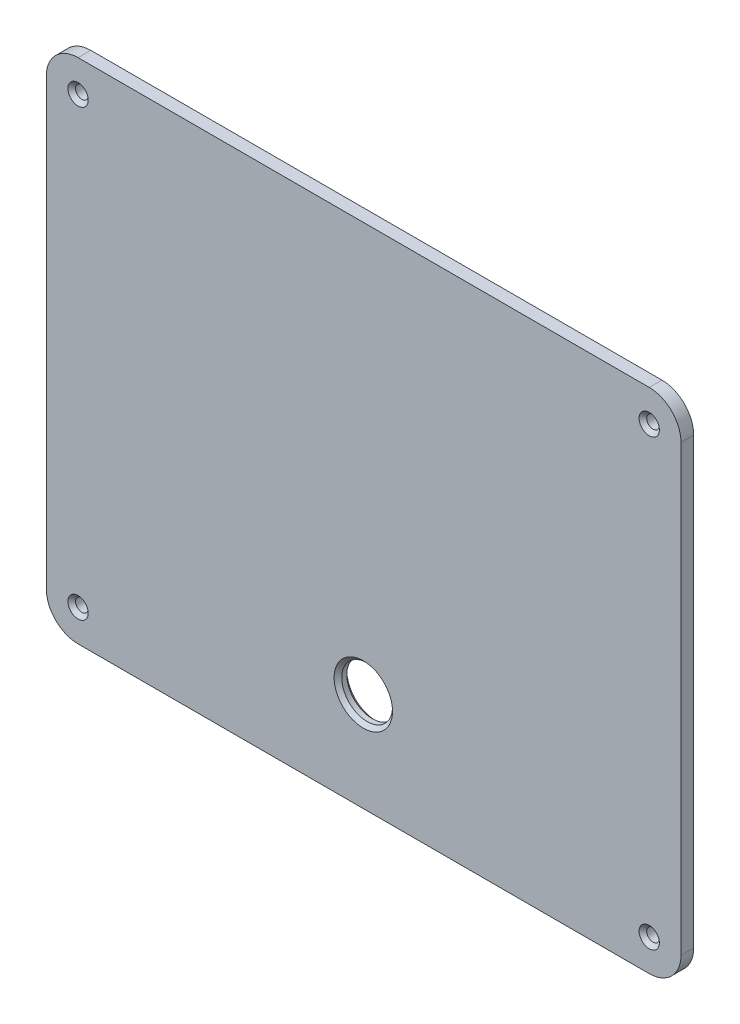
from build123d import *

# Parameters (mm, degrees)
BOSS_EXTRU_1_DEPTH      = 10
ESQUISSE3_R             = 5
ENL_V_MAT_EXTRU_1_DEPTH = 10
CHANFREIN1_SIZE         = 3
ESQUISSE4_R             = 20
ENL_V_MAT_EXTRU_2_DEPTH = 10
CHANFREIN2_SIZE         = 3


with BuildPart() as part:
    # Esquisse1 → Boss.-Extru.1 (new body)
    with BuildSketch(Plane.XY):
        with BuildLine():
            Line((-224.722989012, -199.030461543), (225.277010988, -199.030461543))
            ThreePointArc((225.277010988, -199.030461543), (242.954680517, -191.708131073), (250.277010988, -174.030461543))
            Line((250.277010988, -174.030461543), (250.277010988, 175.969538457))
            ThreePointArc((250.277010988, 175.969538457), (242.954680517, 193.647207986), (225.277010988, 200.969538457))
            Line((225.277010988, 200.969538457), (-224.722989012, 200.969538457))
            ThreePointArc((-224.722989012, 200.969538457), (-242.400658542, 193.647207986), (-249.722989012, 175.969538457))
            Line((-249.722989012, 175.969538457), (-249.722989012, -174.030461543))
            ThreePointArc((-249.722989012, -174.030461543), (-242.400658542, -191.708131073), (-224.722989012, -199.030461543))
        make_face()
    extrude(amount=BOSS_EXTRU_1_DEPTH)

    # Esquisse3 → Enlèv. mat.-Extru.1 (cut)
    with BuildSketch(Plane.XY.offset(10)):
        with Locations((-224.722989012, -174.030461543)):
            Circle(ESQUISSE3_R)
        with Locations((225.277010988, -174.030461543)):
            Circle(ESQUISSE3_R)
        with Locations((225.277010988, 175.969538457)):
            Circle(ESQUISSE3_R)
        with Locations((-224.722989012, 175.969538457)):
            Circle(ESQUISSE3_R)
    extrude(amount=-ENL_V_MAT_EXTRU_1_DEPTH, mode=Mode.SUBTRACT)

    # Chanfrein1
    chanfrein1_edges = [part.edges().sort_by_distance(p)[0] for p in [
        (-229.722989012, 175.969538457, 10),
        (220.277010988, 175.969538457, 10),
        (220.277010988, -174.030461543, 10),
        (-229.722989012, -174.030461543, 10),
    ]]
    chamfer(chanfrein1_edges, length=CHANFREIN1_SIZE)

    # Esquisse4 → Enlèv. mat.-Extru.2 (cut)
    with BuildSketch(Plane.XY.offset(10)):
        with Locations((0, -121.160461543)):
            Circle(ESQUISSE4_R)
    extrude(amount=-ENL_V_MAT_EXTRU_2_DEPTH, mode=Mode.SUBTRACT)

    # Chanfrein2
    chanfrein2_edges = [part.edges().sort_by_distance(p)[0] for p in [
        (-20, -121.160461543, 0),
        (-20, -121.160461543, 10),
    ]]
    chamfer(chanfrein2_edges, length=CHANFREIN2_SIZE)


solid = part.part
